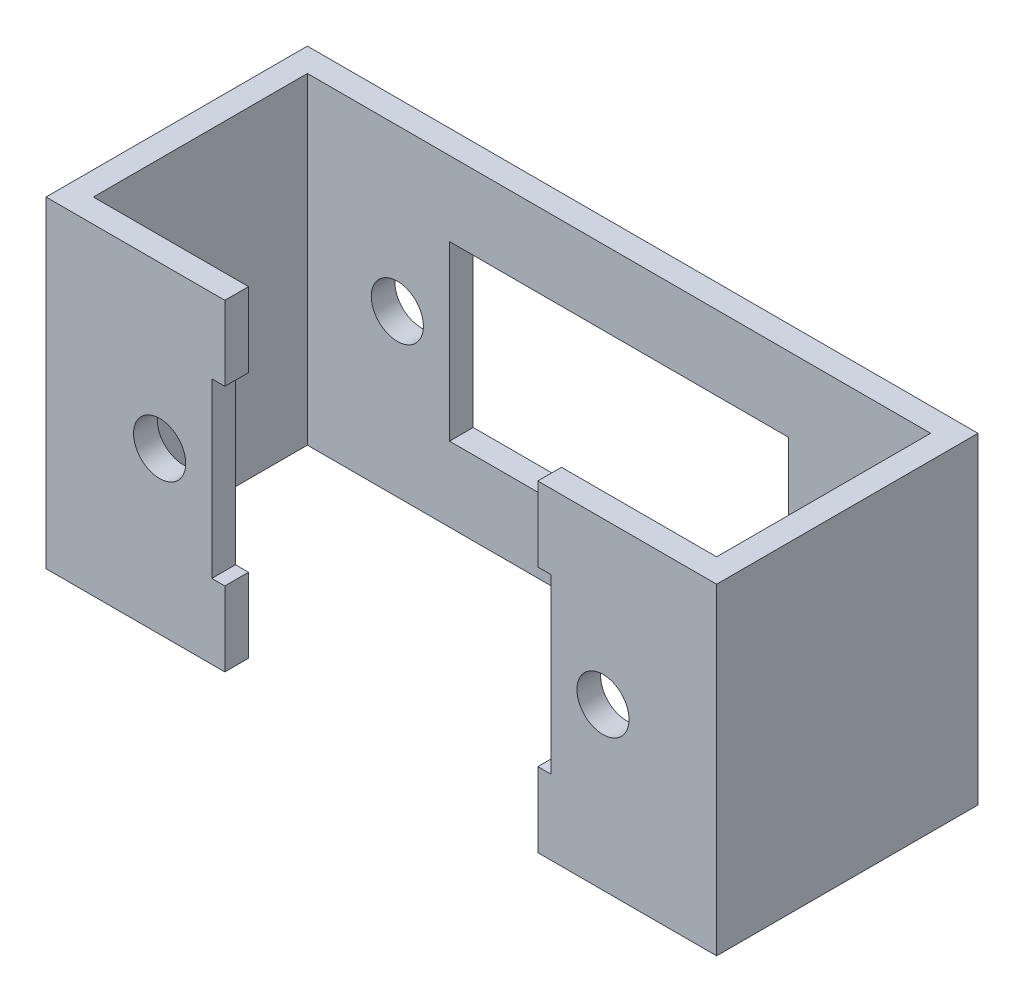
from build123d import *

# Parameters (mm, degrees)
BOSS_EXTRUDE1_DEPTH = 21.6
SKETCH4_R           = 1.75
SKETCH4_W           = 22.75
SKETCH4_H           = 11.6
CUT_EXTRUDE2_DEPTH  = 20


with BuildPart() as part:
    # Sketch2 → Boss-Extrude1 (new body)
    with BuildSketch(Plane(origin=(0, 0, 0), x_dir=(1, 0, 0), z_dir=(0, 1, 0))):
        Polygon((-22.5, 0), (22.5, 0), (22.5, -17.54), (10.5, -17.54), (10.5, -15.95), (20.91, -15.95), (20.91, -1.59), (-20.91, -1.59), (-20.91, -15.95), (-10.5, -15.95), (-10.5, -17.54), (-22.5, -17.54), align=None)
    extrude(amount=BOSS_EXTRUDE1_DEPTH)

    # Sketch4 → Cut-Extrude2 (cut)
    with BuildSketch(Plane(origin=(0, 0, 0), x_dir=(-1, 0, 0), z_dir=(0, 0, -1))):
        with Locations((-14.875, 10.8)):
            Circle(SKETCH4_R)
        with Locations((14.875, 10.8)):
            Circle(SKETCH4_R)
        with Locations((0, 10.8)):
            Rectangle(SKETCH4_W, SKETCH4_H)
    extrude(amount=-CUT_EXTRUDE2_DEPTH, mode=Mode.SUBTRACT)


solid = part.part
